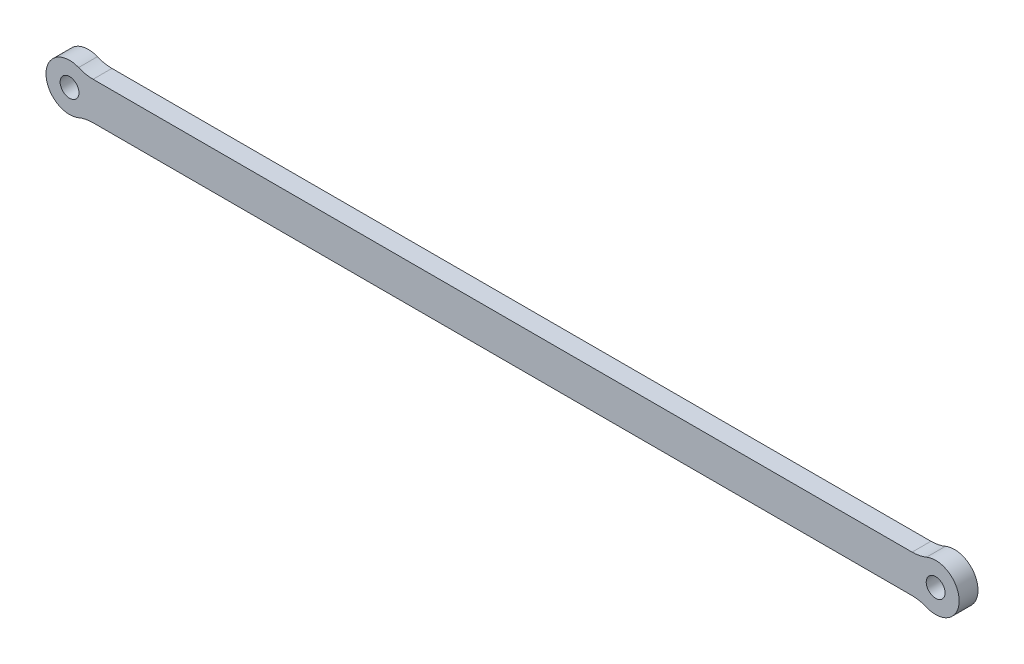
from build123d import *

# Parameters (mm, degrees)
SKIZZE1_R                       = 2.5
AUFSATZ_LINEAR_AUSTRAGEN1_DEPTH = 5


with BuildPart() as part:
    # Skizze1 → Aufsatz-Linear austragen1 (new body)
    with BuildSketch(Plane.XY):
        with BuildLine():
            Line((-108.75, 5), (108.75, 5))
            ThreePointArc((108.75, 5), (110.711161351, 5.194193243), (112.596153846, 5.769230769))
            ThreePointArc((112.596153846, 5.769230769), (121.25, 0), (112.596153846, -5.769230769))
            ThreePointArc((112.596153846, -5.769230769), (110.711161351, -5.194193243), (108.75, -5))
            Line((108.75, -5), (-108.75, -5))
            ThreePointArc((-108.75, -5), (-110.711161351, -5.194193243), (-112.596153846, -5.769230769))
            ThreePointArc((-112.596153846, -5.769230769), (-121.25, 0), (-112.596153846, 5.769230769))
            ThreePointArc((-112.596153846, 5.769230769), (-110.711161351, 5.194193243), (-108.75, 5))
        make_face()
        with Locations((-115, 0)):
            Circle(SKIZZE1_R, mode=Mode.SUBTRACT)
        with Locations((115, 0)):
            Circle(SKIZZE1_R, mode=Mode.SUBTRACT)
    extrude(amount=AUFSATZ_LINEAR_AUSTRAGEN1_DEPTH)


solid = part.part
